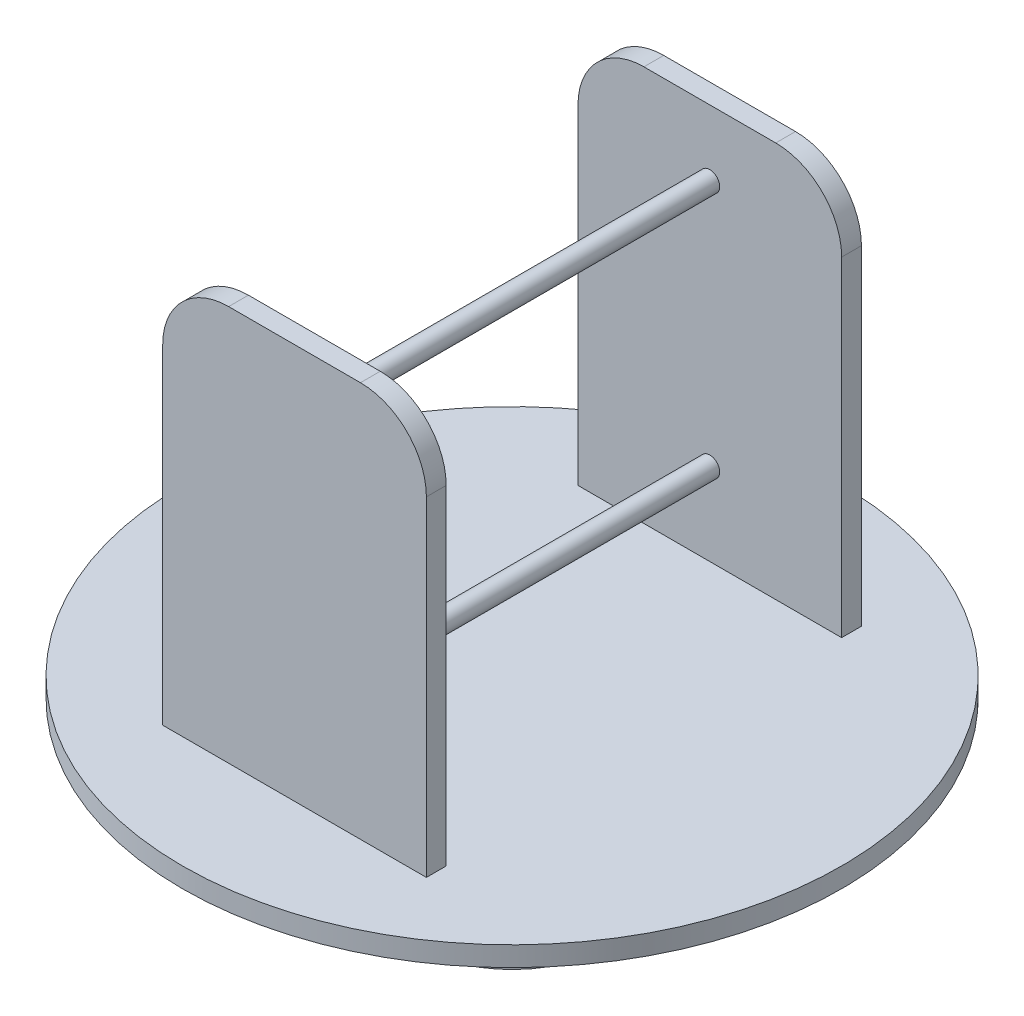
from build123d import *

# Parameters (mm, degrees)
SKETCH1_R           = 50
BOSS_EXTRUDE1_DEPTH = 3
SKETCH2_R           = 15
BOSS_EXTRUDE2_DEPTH = 25
SKETCH3_W           = 40
SKETCH3_H           = 3
BOSS_EXTRUDE3_DEPTH = 60
SKETCH4_R           = 1.5
BOSS_EXTRUDE4_DEPTH = 63
FILLET1_R           = 10


with BuildPart() as part:
    # Sketch1 → Boss-Extrude1 (new body)
    with BuildSketch(Plane(origin=(0, 0, 0), x_dir=(1, 0, 0), z_dir=(0, 1, 0))):
        with Locations(Location((0, 0, 0), (0, 0, 270))):
            Circle(SKETCH1_R)
    extrude(amount=BOSS_EXTRUDE1_DEPTH)

    # Sketch2 → Boss-Extrude2 (add)
    with BuildSketch(Plane(origin=(0, 0, 0), x_dir=(-1, 0, 0), z_dir=(0, -1, 0))):
        with Locations(Location((0, 0, 0), (0, 0, 90))):
            Circle(SKETCH2_R)
    extrude(amount=BOSS_EXTRUDE2_DEPTH)

    # Sketch3 → Boss-Extrude3 (add)
    with BuildSketch(Plane(origin=(0, 3, 0), x_dir=(1, 0, 0), z_dir=(0, 1, 0))):
        with Locations((0, -31.5)):
            Rectangle(SKETCH3_W, SKETCH3_H)
        with Locations((0, 31.5)):
            Rectangle(SKETCH3_W, SKETCH3_H)
    extrude(amount=BOSS_EXTRUDE3_DEPTH)

    # Sketch4 → Boss-Extrude4 (add)
    with BuildSketch(Plane.XY.offset(33)):
        with Locations((0, 53)):
            Circle(SKETCH4_R)
        with Locations((0, 15.5)):
            Circle(SKETCH4_R)
    extrude(amount=-BOSS_EXTRUDE4_DEPTH)

    # Fillet1
    fillet1_edges = [part.edges().sort_by_distance(p)[0] for p in [
        (-20, 63, 31.5),
        (20, 63, 31.5),
        (-20, 63, -31.5),
        (20, 63, -31.5),
    ]]
    fillet(fillet1_edges, radius=FILLET1_R)


solid = part.part
